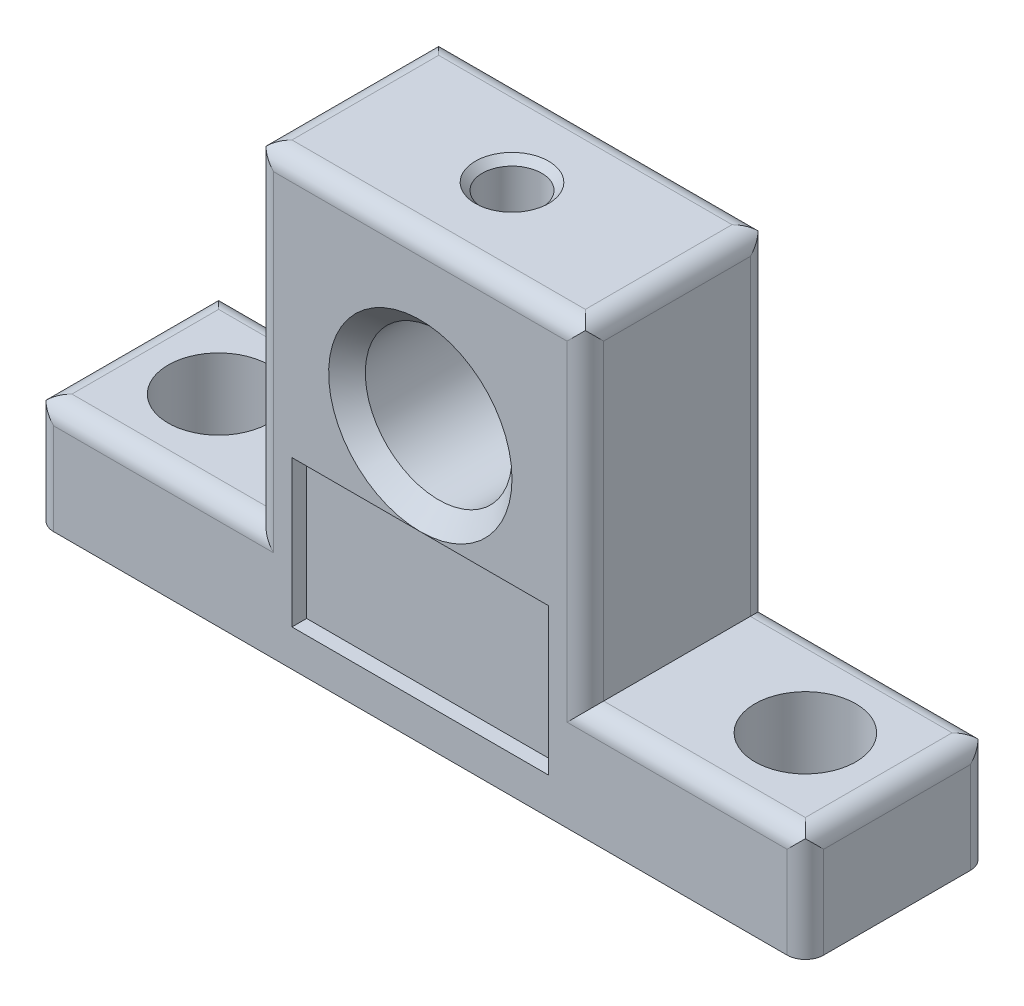
from build123d import *

# Parameters (mm, degrees)
BOSS_EXTRUDE1_DEPTH      = 5
BOSS_EXTRUDE1_DEPTH_BACK = 5
CUT_EXTRUDE1_DEPTH       = 42
CUT_EXTRUDE1_DEPTH_BACK  = 42
SKETCH2_W                = 20
SKETCH2_H                = 16
CUT_EXTRUDE2_DEPTH       = 42
CUT_EXTRUDE2_DEPTH_BACK  = 42
SKETCH3_W                = 63
SKETCH3_H                = 20
BOSS_EXTRUDE2_DEPTH      = 24
CUT_EXTRUDE3_DEPTH       = 10
CUT_EXTRUDE3_DEPTH_BACK  = 10
CUT_EXTRUDE4_DEPTH       = 18
CUT_EXTRUDE4_DEPTH_BACK  = 18
SKETCH8_W                = 2.75
SKETCH8_H                = 6
SKETCH9_W                = 2.75
SKETCH9_H                = 6
SKETCH11_W               = 14
SKETCH11_H               = 8
CUT_EXTRUDE5_DEPTH       = 0.8


with BuildPart() as part:
    # Sketch1 → Boss-Extrude1 (new, two sides: drawn at the far end of the back side and taken through both)
    with BuildSketch(Plane.XY.offset(-BOSS_EXTRUDE1_DEPTH_BACK)):
        with BuildLine():
            Line((-21, 0), (21, 0))
            Line((21, 0), (21, 5))
            ThreePointArc((21, 5), (20.707106781, 5.707106781), (20, 6))
            Line((20, 6), (-20, 6))
            ThreePointArc((-20, 6), (-20.707106781, 5.707106781), (-21, 5))
            Line((-21, 5), (-21, 0))
        make_face()
    extrude(amount=BOSS_EXTRUDE1_DEPTH + BOSS_EXTRUDE1_DEPTH_BACK)

    # Sketch2 → Cut-Extrude1 (cut, two sides: drawn at the far end of the back side and taken through both)
    with BuildSketch(Plane(origin=(0, 0, 0), x_dir=(0, 0, -1), z_dir=(1, 0, 0)).offset(-CUT_EXTRUDE1_DEPTH_BACK)):
        with Locations((0, 3)):
            Rectangle(SKETCH2_W, SKETCH2_H)
        with BuildLine():
            Line((-5, 0), (5, 0))
            Line((5, 0), (5, 5))
            ThreePointArc((5, 5), (4.707106781, 5.707106781), (4, 6))
            Line((4, 6), (-4, 6))
            ThreePointArc((-4, 6), (-4.707106781, 5.707106781), (-5, 5))
            Line((-5, 5), (-5, 0))
        make_face(mode=Mode.SUBTRACT)
    extrude(amount=CUT_EXTRUDE1_DEPTH + CUT_EXTRUDE1_DEPTH_BACK, mode=Mode.SUBTRACT)

    # Sketch3 → Cut-Extrude2 (cut, two sides: drawn at the far end of the back side and taken through both)
    with BuildSketch(Plane(origin=(0, 0, 0), x_dir=(1, 0, 0), z_dir=(0, 1, 0)).offset(-CUT_EXTRUDE2_DEPTH_BACK)):
        Rectangle(SKETCH3_W, SKETCH3_H)
        with BuildLine():
            Line((-21, 4), (-21, -4))
            ThreePointArc((-21, -4), (-20.707106781, -4.707106781), (-20, -5))
            Line((-20, -5), (20, -5))
            ThreePointArc((20, -5), (20.707106781, -4.707106781), (21, -4))
            Line((21, -4), (21, 4))
            ThreePointArc((21, 4), (20.707106781, 4.707106781), (20, 5))
            Line((20, 5), (-20, 5))
            ThreePointArc((-20, 5), (-20.707106781, 4.707106781), (-21, 4))
        make_face(mode=Mode.SUBTRACT)
    extrude(amount=CUT_EXTRUDE2_DEPTH + CUT_EXTRUDE2_DEPTH_BACK, mode=Mode.SUBTRACT)

    # Sketch4 → Boss-Extrude2 (add)
    with BuildSketch(Plane(origin=(0, 0, 0), x_dir=(1, 0, 0), z_dir=(0, 1, 0))):
        with BuildLine():
            Line((-9, 4), (-9, -4))
            ThreePointArc((-9, -4), (-8.707106781, -4.707106781), (-8, -5))
            Line((-8, -5), (8, -5))
            ThreePointArc((8, -5), (8.707106781, -4.707106781), (9, -4))
            Line((9, -4), (9, 4))
            ThreePointArc((9, 4), (8.707106781, 4.707106781), (8, 5))
            Line((8, 5), (-8, 5))
            ThreePointArc((-8, 5), (-8.707106781, 4.707106781), (-9, 4))
        make_face()
    extrude(amount=BOSS_EXTRUDE2_DEPTH)

    # Sketch5 → Cut-Extrude3 (cut, two sides: drawn at the far end of the back side and taken through both)
    with BuildSketch(Plane.XY.offset(-CUT_EXTRUDE3_DEPTH_BACK)):
        with BuildLine():
            Line((-9, 48), (-9, 23))
            ThreePointArc((-9, 23), (-8.707106781, 23.707106781), (-8, 24))
            Line((-8, 24), (8, 24))
            ThreePointArc((8, 24), (8.707106781, 23.707106781), (9, 23))
            Line((9, 23), (9, 48))
            Line((9, 48), (-9, 48))
        make_face()
    extrude(amount=CUT_EXTRUDE3_DEPTH + CUT_EXTRUDE3_DEPTH_BACK, mode=Mode.SUBTRACT)

    # Sketch6 → Cut-Extrude4 (cut, two sides: drawn at the far end of the back side and taken through both)
    with BuildSketch(Plane(origin=(0, 0, 0), x_dir=(0, 0, -1), z_dir=(1, 0, 0)).offset(-CUT_EXTRUDE4_DEPTH_BACK)):
        with BuildLine():
            Line((-5, 48), (-5, 23))
            ThreePointArc((-5, 23), (-4.707106781, 23.707106781), (-4, 24))
            Line((-4, 24), (4, 24))
            ThreePointArc((4, 24), (4.707106781, 23.707106781), (5, 23))
            Line((5, 23), (5, 48))
            Line((5, 48), (-5, 48))
        make_face()
    extrude(amount=CUT_EXTRUDE4_DEPTH + CUT_EXTRUDE4_DEPTH_BACK, mode=Mode.SUBTRACT)

    # Sketch7 → Cut-Revolve1 (revolve, cut)
    with BuildSketch(Plane(origin=(0, 0, 0), x_dir=(0, 0, -1), z_dir=(1, 0, 0))):
        Polygon((-5, 15), (-5, 20), (-4, 19), (4, 19), (5, 20), (5, 15), align=None)
    revolve(axis=Axis((0, 15, -5), (0, 0, 1)), mode=Mode.SUBTRACT)

    # Sketch8 → Cut-Revolve2 (revolve, cut)
    with BuildSketch(Plane.XY):
        with Locations((-17.375, 3)):
            Rectangle(SKETCH8_W, SKETCH8_H)
    revolve(axis=Axis((-16, 6, 0), (0, -1, 0)), mode=Mode.SUBTRACT)

    # Sketch9 → Cut-Revolve3 (revolve, cut)
    with BuildSketch(Plane.XY):
        with Locations((14.625, 3)):
            Rectangle(SKETCH9_W, SKETCH9_H)
    revolve(axis=Axis((16, 6, 0), (0, -1, 0)), mode=Mode.SUBTRACT)

    # Sketch10 → Cut-Revolve4 (revolve, cut)
    with BuildSketch(Plane.XY):
        Polygon((0, 24), (2, 24), (1.621, 23.621), (1.621, 19), (2, 18.621), (2, 15), (0, 15), align=None)
    revolve(axis=Axis((0, 15, 0), (0, 1, 0)), mode=Mode.SUBTRACT)

    # Sketch11 → Cut-Extrude5 (cut)
    with BuildSketch(Plane.XY.offset(5)):
        with Locations((0, 6)):
            Rectangle(SKETCH11_W, SKETCH11_H)
    extrude(amount=-CUT_EXTRUDE5_DEPTH, mode=Mode.SUBTRACT)


solid = part.part
